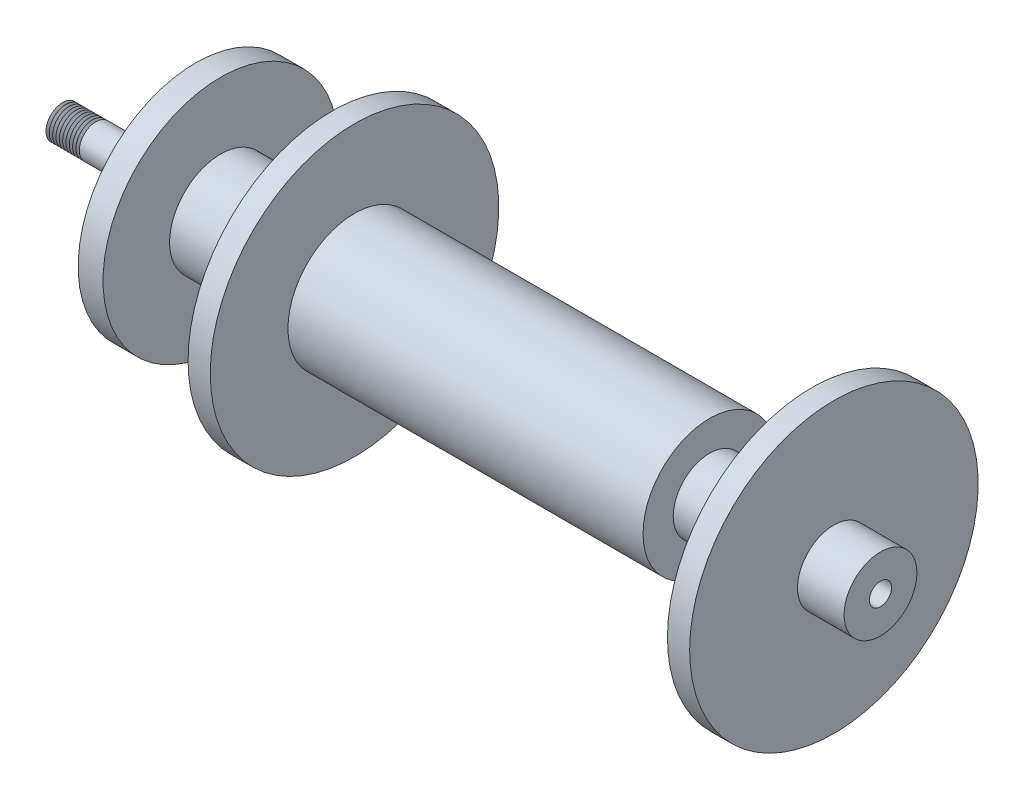
from build123d import *

# Parameters (mm, degrees)
IZIM14_3_W = 12
IZIM14_3_H = 3
IZIM14_4_R = 3


with BuildPart() as part:
    # Çizim1 → Döndür1 (revolve)
    with BuildSketch(Plane.XY):
        Polygon((-80, 65), (-90, 65), (-90, 20), (-85, 20), (-85, 21.5), (-75, 21.5), (-75, 20), (60, 20), (60, 2.5), (146.982260797, 2.5), (146.982260797, 5), (156.982260797, 5), (156.982260797, 16.404709691), (136, 16.404709691), (136, 65), (126, 65), (126, 30), (104.164354306, 30), (101.767137814, 16.404709691), (80, 16.404709691), (80, 30), (-80, 30), align=None)
    revolve(axis=Axis((-200.777867174, 0, 0), (1, 0, 0)))

    # Çizim14 → Döndür3 (revolve)
    with BuildSketch(Plane.XY):
        Polygon((-85.083552442, 21.610379823), (-85.083552442, 20.999986544), (-82.083552442, 20.999986544), (-76.083552442, 20.999986544), (-75, 20.999986544), (-74.527654889, 20.999986544), (-74.527654889, 21.610379823), align=None)
    revolve(axis=Axis((56.251661195, 0, 0), (1, 0, 0)))

    # Çizim14<3> → Kes-Döndür1 (revolve, cut)
    with BuildSketch(Plane.XY):
        with Locations((-79.083552442, 19.499986544)):
            Rectangle(IZIM14_3_W, IZIM14_3_H)
    revolve(axis=Axis((56.251661195, 0, 0), (1, 0, 0)), mode=Mode.SUBTRACT)


with BuildPart() as body_2:
    # Çizim10 → Döndür2 (revolve)
    with BuildSketch(Plane.XY):
        Polygon((9.668154457, 0), (9.668154457, 15), (-115.308411432, 15), (-115.308411432, 23), (-140.308411432, 23), (-140.308411432, 53), (-151.52431256, 53), (-151.52431256, 7.5), (-196.52431256, 7.5), (-197.27431256, 6.200961894), (-198.02431256, 7.5), (-198.77431256, 6.200961894), (-199.52431256, 7.5), (-200.27431256, 6.200961894), (-201.02431256, 7.5), (-201.77431256, 6.200961894), (-202.52431256, 7.5), (-203.27431256, 6.200961894), (-204.02431256, 7.5), (-204.77431256, 6.200961894), (-205.52431256, 7.5), (-206.27431256, 6.200961894), (-207.02431256, 7.5), (-207.77431256, 6.200961894), (-208.52431256, 7.5), (-209.27431256, 6.200961894), (-210.02431256, 7.5), (-210.77431256, 6.200961894), (-211.52431256, 7.5), (-211.52431256, 0), align=None)
    revolve(axis=Axis((56.251661195, 0, 0), (-1, 0, 0)))


with BuildPart() as body_3:
    # Çizim14<4> → Döndür4 (revolve)
    with BuildSketch(Plane.XY):
        with Locations((-82.083552442, 17.999986544)):
            Circle(IZIM14_4_R)
        with Locations((-76.083552442, 17.999986544)):
            Circle(IZIM14_4_R)
    revolve(axis=Axis((56.251661195, 0, 0), (1, 0, 0)))


solid = Compound([part.part, body_2.part, body_3.part])
